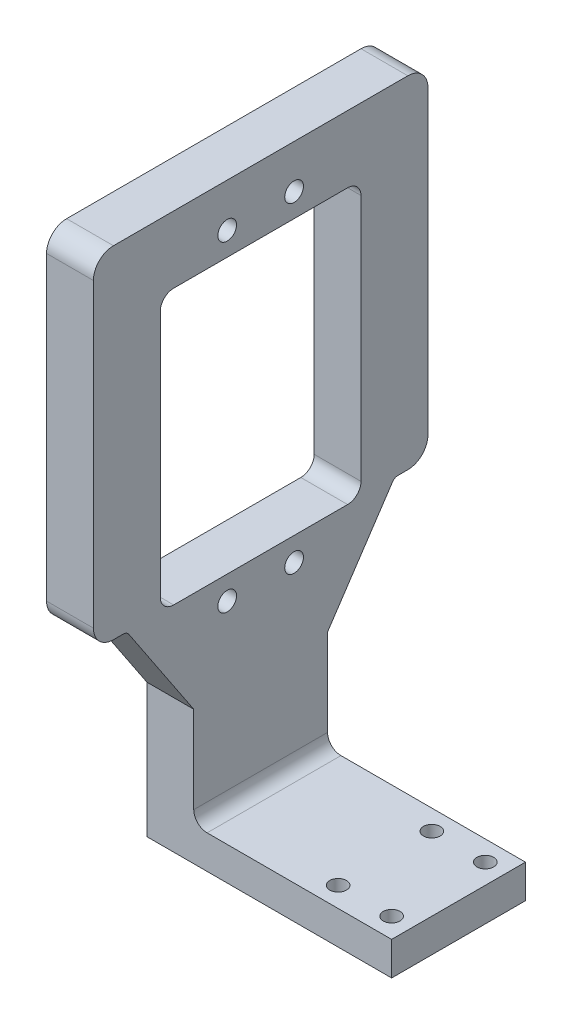
from build123d import *

# Parameters (mm, degrees)
SKETCH1_W           = 36.58
SKETCH1_H           = 20
SKETCH1_R           = 1.25
BOSS_EXTRUDE1_DEPTH = 5
SKETCH3_W           = 20
SKETCH3_H           = 30
SKETCH3_W_2         = 10
SKETCH3_H_2         = 41
BOSS_EXTRUDE2_DEPTH = 7
FILLET1_R           = 3
FILLET2_R           = 1
CUT_EXTRUDE1_REACH  = 101.795
SKETCH6_R           = 1.4
FILLET3_R           = 2


with BuildPart() as part:
    # Sketch1 → Boss-Extrude1 (new body)
    with BuildSketch(Plane(origin=(0, 0, 0), x_dir=(1, 0, 0), z_dir=(0, 1, 0))):
        with Locations((18.29, 10)):
            Rectangle(SKETCH1_W, SKETCH1_H)
        with Locations(Location((25.58, 3, 0), (0, 0, 270))):
            Circle(SKETCH1_R, mode=Mode.SUBTRACT)
        with Locations(Location((33.58, 3, 0), (0, 0, 270))):
            Circle(SKETCH1_R, mode=Mode.SUBTRACT)
        with Locations(Location((33.58, 17, 0), (0, 0, 90))):
            Circle(SKETCH1_R, mode=Mode.SUBTRACT)
        with Locations(Location((25.58, 17, 0), (0, 0, 90))):
            Circle(SKETCH1_R, mode=Mode.SUBTRACT)
    extrude(amount=BOSS_EXTRUDE1_DEPTH)

    # Sketch3 → Boss-Extrude2 (add)
    with BuildSketch(Plane.ZY):
        with Locations((-10, 20)):
            Rectangle(SKETCH3_W, SKETCH3_H)
        Polygon((-20, 20), (-20, 35), (-25, 35), (-30, 35), align=None)
        with Locations((-30, 55.5)):
            Rectangle(SKETCH3_W_2, SKETCH3_H_2)
        Polygon((-25, 76), (5, 76), (15, 76), (15, 86), (-35, 86), (-35, 76), align=None)
        with Locations((10, 55.5)):
            Rectangle(SKETCH3_W_2, SKETCH3_H_2)
        Polygon((5, 35), (0, 35), (0, 20), (10, 35), align=None)
    extrude(amount=-BOSS_EXTRUDE2_DEPTH)

    # Fillet1
    fillet1_edges = [part.edges().sort_by_distance(p)[0] for p in [
        (3.5, 86, 15),
        (3.5, 35, 15),
        (3.5, 35, -35),
        (3.5, 86, -35),
    ]]
    fillet(fillet1_edges, radius=FILLET1_R)

    # Fillet2
    fillet2_edges = [part.edges().sort_by_distance(p)[0] for p in [
        (3.5, 35, 10),
        (3.5, 35, -30),
    ]]
    fillet(fillet2_edges, radius=FILLET2_R)

    # Sketch6 → Cut-Extrude1 (cut, up to next)
    with BuildSketch(Plane.ZY, mode=Mode.PRIVATE) as cut_extrude1_sk1:
        with Locations((-15, 31.5)):
            Circle(SKETCH6_R)
    cut_extrude1_tool1 = extrude(cut_extrude1_sk1.sketch, amount=-CUT_EXTRUDE1_REACH, mode=Mode.PRIVATE) & part.part
    # Sketch6 → Cut-Extrude1 (cut, up to next)
    with BuildSketch(Plane.ZY, mode=Mode.PRIVATE) as cut_extrude1_sk2:
        with Locations((-5, 31.5)):
            Circle(SKETCH6_R)
    cut_extrude1_tool2 = extrude(cut_extrude1_sk2.sketch, amount=-CUT_EXTRUDE1_REACH, mode=Mode.PRIVATE) & part.part
    # Sketch6 → Cut-Extrude1 (cut, up to next)
    with BuildSketch(Plane.ZY, mode=Mode.PRIVATE) as cut_extrude1_sk3:
        with Locations((-15, 79.5)):
            Circle(SKETCH6_R)
    cut_extrude1_tool3 = extrude(cut_extrude1_sk3.sketch, amount=-CUT_EXTRUDE1_REACH, mode=Mode.PRIVATE) & part.part
    # Sketch6 → Cut-Extrude1 (cut, up to next)
    with BuildSketch(Plane.ZY, mode=Mode.PRIVATE) as cut_extrude1_sk4:
        with Locations((-5, 79.5)):
            Circle(SKETCH6_R)
    cut_extrude1_tool4 = extrude(cut_extrude1_sk4.sketch, amount=-CUT_EXTRUDE1_REACH, mode=Mode.PRIVATE) & part.part
    add(cut_extrude1_tool1.solids().sort_by_distance((0, 31.5, -15))[0], mode=Mode.SUBTRACT)
    add(cut_extrude1_tool2.solids().sort_by_distance((0, 31.5, -5))[0], mode=Mode.SUBTRACT)
    add(cut_extrude1_tool3.solids().sort_by_distance((0, 79.5, -15))[0], mode=Mode.SUBTRACT)
    add(cut_extrude1_tool4.solids().sort_by_distance((0, 79.5, -5))[0], mode=Mode.SUBTRACT)

    # Fillet3
    fillet3_edges = [part.edges().sort_by_distance(p)[0] for p in [
        (3.5, 76, 5),
        (3.5, 76, -25),
        (3.5, 35, -25),
        (3.5, 35, 5),
        (7, 5, -10),
    ]]
    fillet(fillet3_edges, radius=FILLET3_R)


solid = part.part
